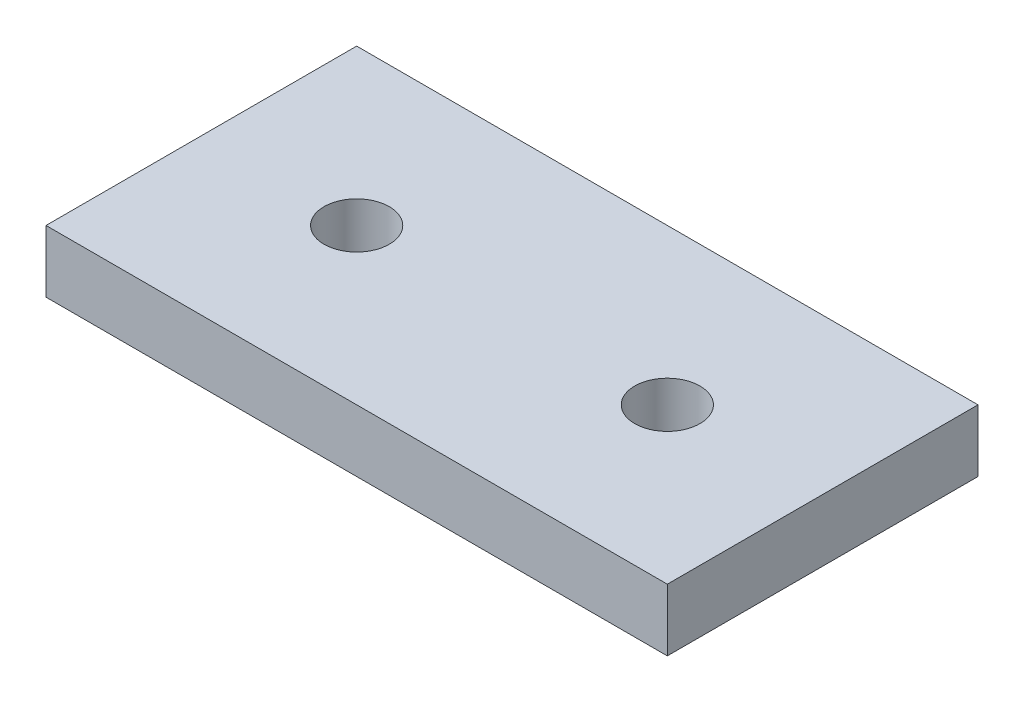
from build123d import *

# Parameters (mm, degrees)
SKETCH_1_W      = 40
SKETCH_1_H      = 20
SKETCH_1_R      = 2.1
EXTRUDE_1_DEPTH = 4


with BuildPart() as part:
    # 草图1 → 凸台-拉伸1 (new body)
    with BuildSketch(Plane(origin=(0, 0, 0), x_dir=(1, 0, 0), z_dir=(0, 1, 0))):
        Rectangle(SKETCH_1_W, SKETCH_1_H)
        with Locations(Location((-10, 0, 0), (0, 0, 270))):
            Circle(SKETCH_1_R, mode=Mode.SUBTRACT)
        with Locations(Location((10, 0, 0), (0, 0, 270))):
            Circle(SKETCH_1_R, mode=Mode.SUBTRACT)
    extrude(amount=EXTRUDE_1_DEPTH)


solid = part.part
